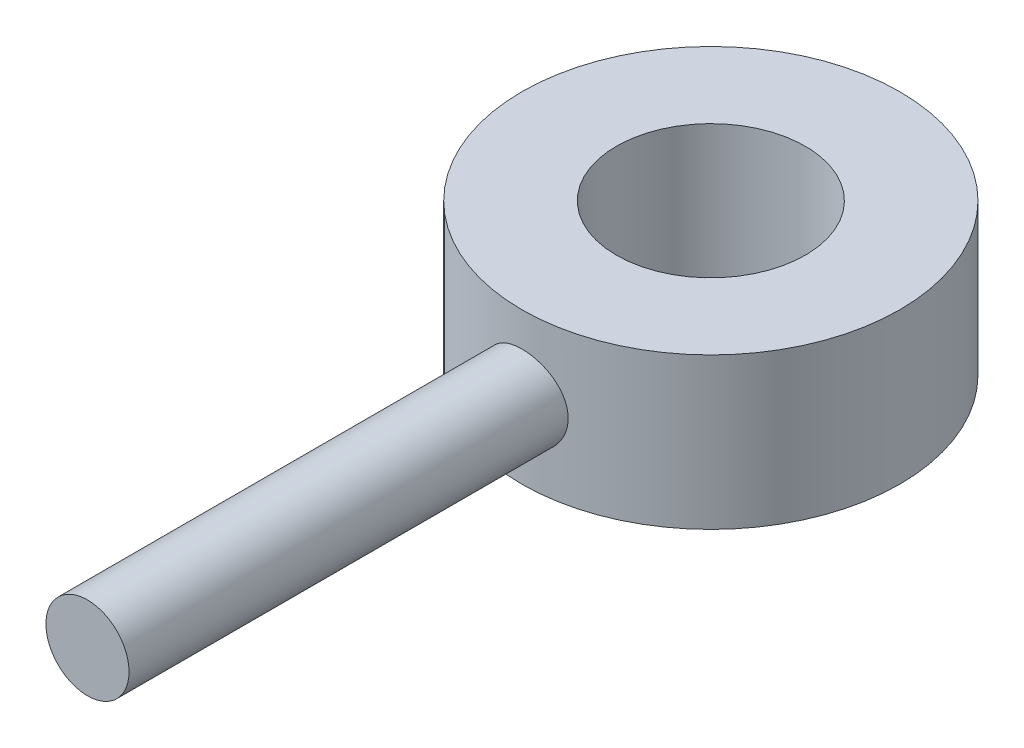
from build123d import *

# Parameters (mm, degrees)
SKETCH1_R           = 5
SKETCH1_R_2         = 2.5
BOSS_EXTRUDE1_DEPTH = 4
SKETCH3_R           = 1.1
BOSS_EXTRUDE3_DEPTH = 14


with BuildPart() as part:
    # Sketch1 → Boss-Extrude1 (new body)
    with BuildSketch(Plane(origin=(0, 0, 0), x_dir=(1, 0, 0), z_dir=(0, 1, 0))):
        with Locations(Location((0, 0, 0), (0, 0, 270))):
            Circle(SKETCH1_R)
        with Locations(Location((0, 0, 0), (0, 0, 270))):
            Circle(SKETCH1_R_2, mode=Mode.SUBTRACT)
    extrude(amount=BOSS_EXTRUDE1_DEPTH)

    # Sketch3 → Boss-Extrude3 (add)
    with BuildSketch(Plane.XY.offset(16.5)):
        with Locations((0, 2)):
            Circle(SKETCH3_R)
    extrude(amount=-BOSS_EXTRUDE3_DEPTH)


solid = part.part
